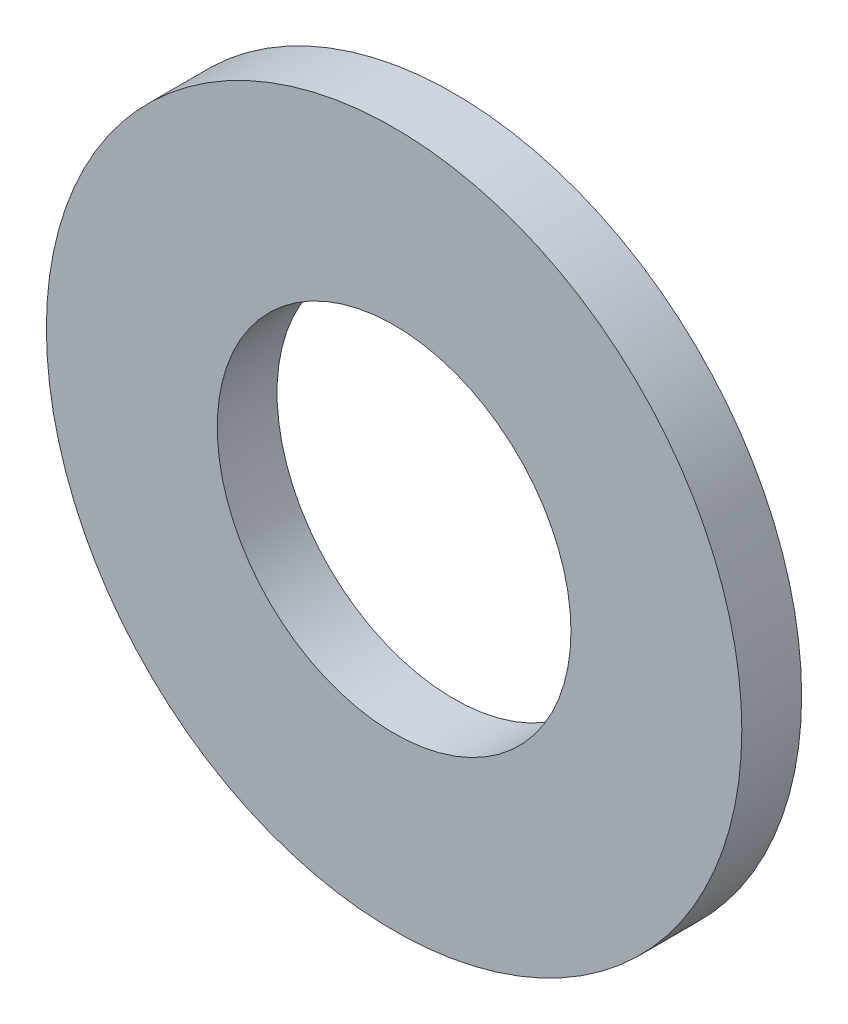
from build123d import *

# Parameters (mm, degrees)
ESQUISSE1_R        = 20.35
ESQUISSE1_R_2      = 10.35
BOSS_EXTRU_1_DEPTH = 3.5


with BuildPart() as part:
    # Esquisse1 → Boss.-Extru.1 (new body)
    with BuildSketch(Plane.XY):
        Circle(ESQUISSE1_R)
        Circle(ESQUISSE1_R_2, mode=Mode.SUBTRACT)
    extrude(amount=BOSS_EXTRU_1_DEPTH)


solid = part.part
